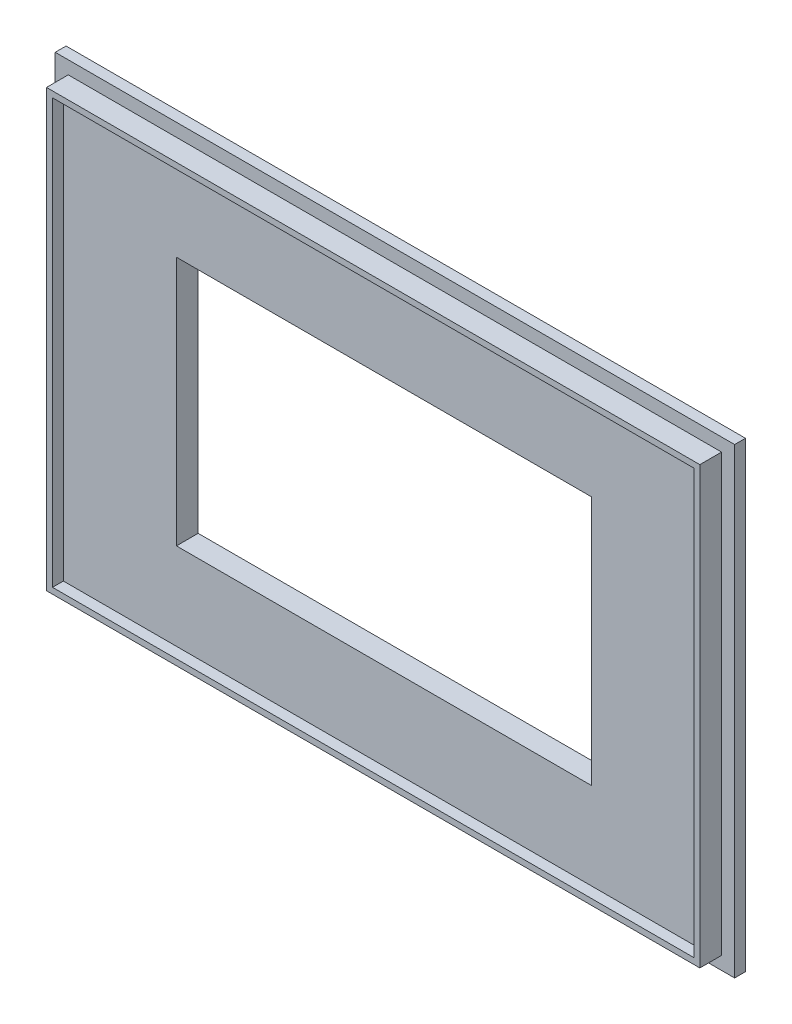
from build123d import *

# Parameters (mm, degrees)
SKETCH1_W           = 158.75
SKETCH1_H           = 107.95
BOSS_EXTRUDE1_DEPTH = 2.54
SKETCH2_W           = 152.654
SKETCH2_H           = 101.854
BOSS_EXTRUDE2_DEPTH = 5.08
SKETCH3_W           = 149.86
SKETCH3_H           = 99.06
CUT_EXTRUDE1_DEPTH  = 2.54
SKETCH4_W           = 97.028
SKETCH4_H           = 58.42
CUT_EXTRUDE2_DEPTH  = 97.122305684


with BuildPart() as part:
    # Sketch1 → Boss-Extrude1 (new body)
    with BuildSketch(Plane.XY):
        Rectangle(SKETCH1_W, SKETCH1_H)
    extrude(amount=BOSS_EXTRUDE1_DEPTH)

    # Sketch2 → Boss-Extrude2 (add)
    with BuildSketch(Plane.XY.offset(2.54)):
        Rectangle(SKETCH2_W, SKETCH2_H)
    extrude(amount=BOSS_EXTRUDE2_DEPTH)

    # Sketch3 → Cut-Extrude1 (cut)
    with BuildSketch(Plane.XY.offset(7.62)):
        Rectangle(SKETCH3_W, SKETCH3_H)
    extrude(amount=-CUT_EXTRUDE1_DEPTH, mode=Mode.SUBTRACT)

    # Sketch4 → Cut-Extrude2 (cut, through all)
    with BuildSketch(Plane.XY.offset(5.08)):
        Rectangle(SKETCH4_W, SKETCH4_H)
    extrude(amount=-CUT_EXTRUDE2_DEPTH, mode=Mode.SUBTRACT)


solid = part.part
